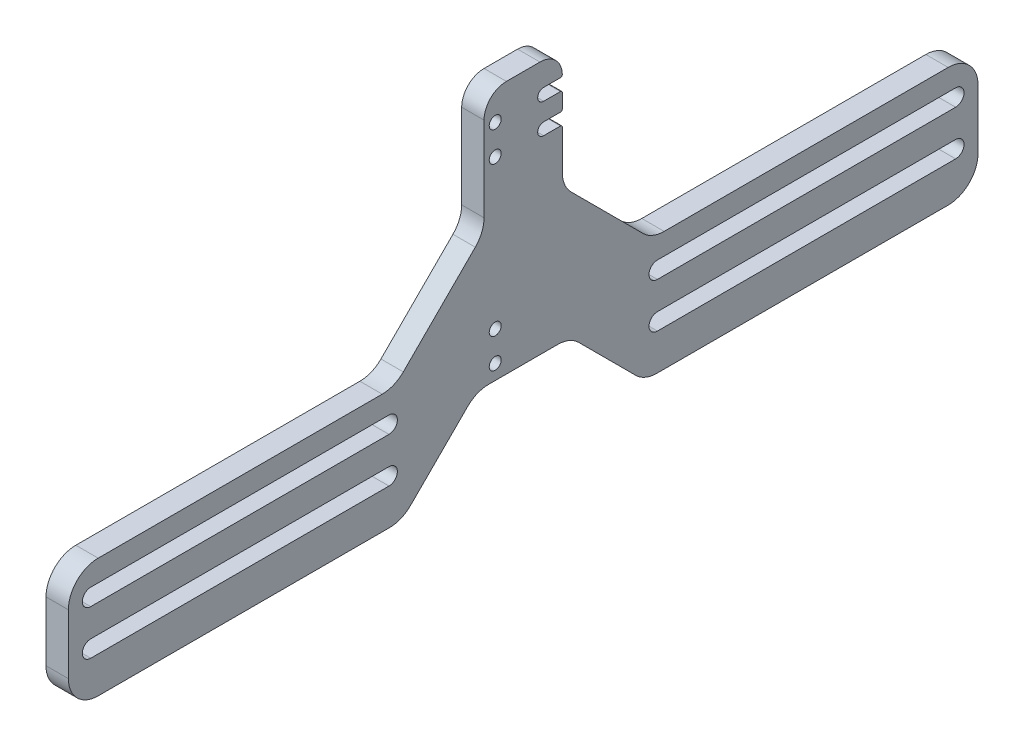
from build123d import *

# Parameters (mm, degrees)
BOSS_EXTRUDE1_DEPTH    = 9.525
CUT_EXTRUDE1_DEPTH     = 239.991257685
CUT_EXTRUDE3_DEPTH     = 239.991257685
F_10_CLEARANCE_HOLE1_D = 5.1054
FILLET1_R              = 9.525
FILLET2_R              = 12.7
CUT_EXTRUDE4_DEPTH     = 239.991257685
FILLET3_R              = 0.79375


with BuildPart() as part:
    # Sketch1 → Boss-Extrude1 (new body)
    with BuildSketch(Plane(origin=(0, 0, 0), x_dir=(0, 0, -1), z_dir=(1, 0, 0))):
        Polygon((-193.675, 0), (193.675, 0), (193.675, 50.8), (54.76875, 50.8), (16.66875, 88.9), (16.66875, 139.7), (-16.66875, 139.7), (-16.66875, 88.9), (-54.76875, 50.8), (-193.675, 50.8), align=None)
    extrude(amount=BOSS_EXTRUDE1_DEPTH)

    # Sketch2 → Cut-Extrude1 (cut, through all)
    with BuildSketch(Plane(origin=(9.525, 0, 0), x_dir=(0, 0, -1), z_dir=(1, 0, 0))):
        with BuildLine():
            Line((-184.15, 34.528125), (-57.15, 34.528125))
            ThreePointArc((-57.15, 34.528125), (-53.578125, 38.1), (-57.15, 41.671875))
            Line((-57.15, 41.671875), (-184.15, 41.671875))
            ThreePointArc((-184.15, 41.671875), (-187.721875, 38.1), (-184.15, 34.528125))
        make_face()
        with BuildLine():
            Line((-184.15, 15.478125), (-57.15, 15.478125))
            ThreePointArc((-57.15, 15.478125), (-53.578125, 19.05), (-57.15, 22.621875))
            Line((-57.15, 22.621875), (-184.15, 22.621875))
            ThreePointArc((-184.15, 22.621875), (-187.721875, 19.05), (-184.15, 15.478125))
        make_face()
    cut_extrude1 = extrude(amount=-CUT_EXTRUDE1_DEPTH, mode=Mode.SUBTRACT)

    # Mirror1: Cut-Extrude1 across plane
    add(cut_extrude1.mirror(Plane.XY), mode=Mode.SUBTRACT)

    # Sketch4 → Cut-Extrude3 (cut, through all)
    with BuildSketch(Plane(origin=(9.525, 0, 0), x_dir=(0, 0, -1), z_dir=(1, 0, 0))):
        Polygon((-51.687213274, 0), (-19.937213274, 31.75), (19.937213274, 31.75), (51.687213274, 0), align=None)
    extrude(amount=-CUT_EXTRUDE3_DEPTH, mode=Mode.SUBTRACT)

    # #10 Clearance Hole1 (through all)
    with Locations(Plane(origin=(9.525, 0, 0), x_dir=(0, 0, -1), z_dir=(1, 0, 0))):
        with Locations((-11.90625, 127), (11.90625, 127), (-11.90625, 114.3), (-11.90625, 38.1), (11.90625, 114.3), (-11.90625, 50.8)):
            Hole(F_10_CLEARANCE_HOLE1_D / 2)

    # Fillet1
    fillet1_edges = [part.edges().sort_by_distance(p)[0] for p in [
        (4.7625, 139.7, 16.66875),
        (4.7625, 139.7, -16.66875),
    ]]
    fillet(fillet1_edges, radius=FILLET1_R)

    # Fillet2
    fillet2_edges = [part.edges().sort_by_distance(p)[0] for p in [
        (4.7625, 50.8, 193.675),
        (4.7625, 50.8, 54.76875),
        (4.7625, 88.9, 16.66875),
        (4.7625, 88.9, -16.66875),
        (4.7625, 50.8, -54.76875),
        (4.7625, 50.8, -193.675),
        (4.7625, 0, -193.675),
        (4.7625, 0, 193.675),
        (4.7625, 31.75, 19.937213274),
        (4.7625, 31.75, -19.937213274),
        (4.7625, 0, -51.687213274),
        (4.7625, 0, 51.687213274),
    ]]
    fillet(fillet2_edges, radius=FILLET2_R)

    # Sketch7 → Cut-Extrude4 (cut, through all)
    with BuildSketch(Plane(origin=(9.525, 0, 0), x_dir=(0, 0, -1), z_dir=(1, 0, 0))):
        with BuildLine():
            Line((11.90625, 129.5527), (16.66875, 129.5527))
            ThreePointArc((16.66875, 129.5527), (19.22145, 127), (16.66875, 124.4473))
            Line((16.66875, 124.4473), (11.90625, 124.4473))
            Line((11.90625, 124.4473), (8.73125, 124.4473))
            ThreePointArc((8.73125, 124.4473), (6.17855, 127), (8.73125, 129.5527))
            Line((8.73125, 129.5527), (11.90625, 129.5527))
        make_face()
        with BuildLine():
            Line((16.66875, 116.8527), (11.90625, 116.8527))
            Line((11.90625, 116.8527), (8.73125, 116.8527))
            ThreePointArc((8.73125, 116.8527), (6.17855, 114.3), (8.73125, 111.7473))
            Line((8.73125, 111.7473), (11.90625, 111.7473))
            Line((11.90625, 111.7473), (16.66875, 111.7473))
            ThreePointArc((16.66875, 111.7473), (19.22145, 114.3), (16.66875, 116.8527))
        make_face()
    extrude(amount=-CUT_EXTRUDE4_DEPTH, mode=Mode.SUBTRACT)

    # Fillet3
    fillet3_edges = [part.edges().sort_by_distance(p)[0] for p in [
        (4.7625, 111.7473, -16.66875),
        (4.7625, 116.8527, -16.66875),
        (4.7625, 124.4473, -16.66875),
        (4.7625, 129.5527, -16.66875),
    ]]
    fillet(fillet3_edges, radius=FILLET3_R)


solid = part.part
